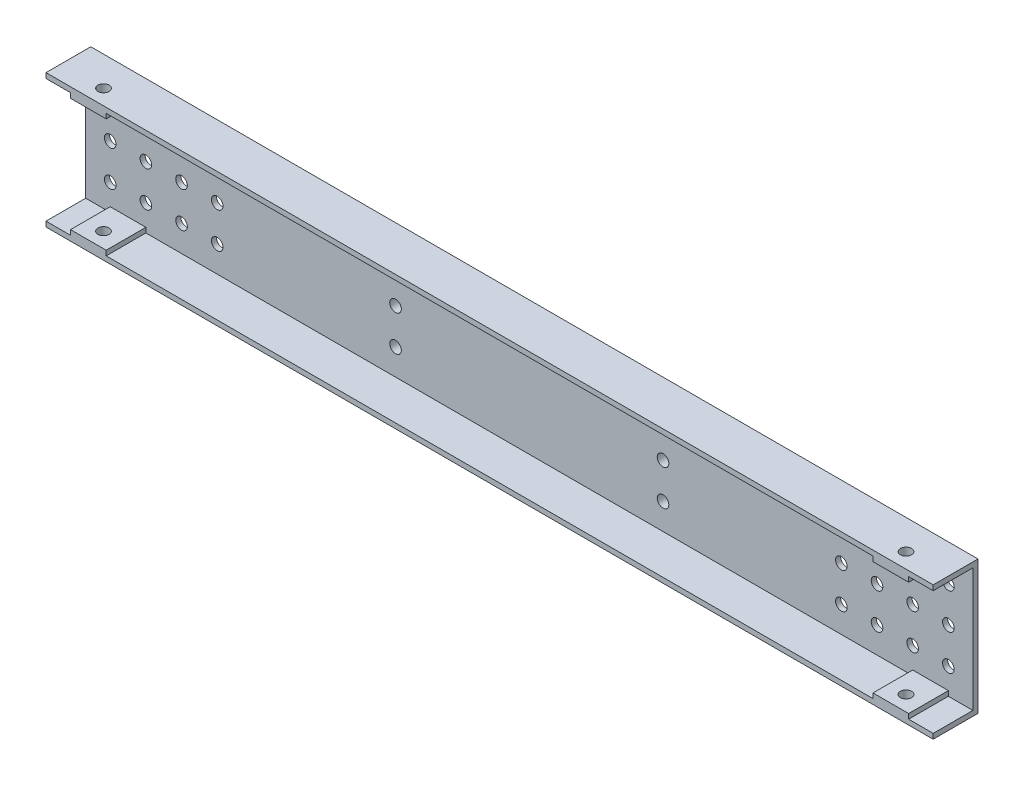
from build123d import *

# Parameters (mm, degrees)
SKETCH_1_W             = 1990
SKETCH_1_H             = 300
SKETCH_1_R             = 13
EXTRUDE_464_DEPTH      = 11.5
EXTRUDE_1_DEPTH        = 89
SKETCH_3_R             = 13
CUT_EXTRUDE_1_DEPTH    = 1045.090633039
PATTERN_LINEAR_1_COUNT = 3
PATTERN_LINEAR_1_PITCH = 80
EXTRUDE_START          = 16
SKETCH_7_W             = 70
SKETCH_7_H             = 230
SKETCH_7_R             = 13
EXTRUDE_2_DEPTH        = 16
SKETCH_8_R             = 12.5
CUT_EXTRUDE_2_DEPTH    = 1045.090633039


with BuildPart() as part:
    # 草图1 → Extrude 464 (new body)
    with BuildSketch(Plane.XY):
        with Locations((0, 150)):
            Rectangle(SKETCH_1_W, SKETCH_1_H)
        with Locations((300, 230)):
            Circle(SKETCH_1_R, mode=Mode.SUBTRACT)
        with Locations((300, 150)):
            Circle(SKETCH_1_R, mode=Mode.SUBTRACT)
        with Locations((300, 70)):
            Circle(SKETCH_1_R, mode=Mode.SUBTRACT)
        with Locations(Location((-300, 70, 0), (0, 0, 180))):
            Circle(SKETCH_1_R, mode=Mode.SUBTRACT)
        with Locations(Location((-300, 150, 0), (0, 0, 180))):
            Circle(SKETCH_1_R, mode=Mode.SUBTRACT)
        with Locations(Location((-300, 230, 0), (0, 0, 180))):
            Circle(SKETCH_1_R, mode=Mode.SUBTRACT)
    extrude(amount=EXTRUDE_464_DEPTH)

    # 草图2 → 凸台-拉伸1 (add)
    with BuildSketch(Plane.XY.offset(11.5)):
        Polygon((-995, 300), (995, 300), (995, 288.5), (940, 288.5), (940, 277.5), (860, 277.5), (860, 288.5), (-860, 288.5), (-860, 277.5), (-940, 277.5), (-940, 288.5), (-995, 288.5), align=None)
        Polygon((-995, 0), (995, 0), (995, 11.5), (940, 11.5), (940, 22.5), (860, 22.5), (860, 11.5), (-860, 11.5), (-860, 22.5), (-940, 22.5), (-940, 11.5), (-995, 11.5), align=None)
    extrude(amount=EXTRUDE_1_DEPTH)

    # 草图3 → 切除-拉伸1 (cut, through all)
    with BuildSketch(Plane(origin=(0, 0, 0), x_dir=(-1, 0, 0), z_dir=(0, 0, -1))):
        with Locations((940, 70)):
            Circle(SKETCH_3_R)
        with Locations((860, 70)):
            Circle(SKETCH_3_R)
        with Locations((780, 70)):
            Circle(SKETCH_3_R)
        with Locations((700, 70)):
            Circle(SKETCH_3_R)
        with Locations((-940, 70)):
            Circle(SKETCH_3_R)
        with Locations((-860, 70)):
            Circle(SKETCH_3_R)
        with Locations((-780, 70)):
            Circle(SKETCH_3_R)
        with Locations((-700, 70)):
            Circle(SKETCH_3_R)
    cut_extrude_1 = extrude(amount=-CUT_EXTRUDE_1_DEPTH, mode=Mode.SUBTRACT)

    # 阵列(线性)1: 切除-拉伸1 ×3
    with Locations(*[(0, i * PATTERN_LINEAR_1_PITCH, 0) for i in range(1, PATTERN_LINEAR_1_COUNT)]):
        add(cut_extrude_1, mode=Mode.SUBTRACT)

    # 草图7 → 凸台-拉伸2 (add)
    # profile 1 of 2: a face of its own
    with BuildSketch(Plane(origin=(0, 0, 0), x_dir=(-1, 0, 0), z_dir=(0, 0, -1)).offset(EXTRUDE_START)):
        with Locations((300, 150)):
            Rectangle(SKETCH_7_W, SKETCH_7_H)
        with Locations((300, 230)):
            Circle(SKETCH_7_R, mode=Mode.SUBTRACT)
        with Locations((300, 150)):
            Circle(SKETCH_7_R, mode=Mode.SUBTRACT)
        with Locations((300, 70)):
            Circle(SKETCH_7_R, mode=Mode.SUBTRACT)
    # profile 2 of 2: a face of its own
    with BuildSketch(Plane(origin=(0, 0, 0), x_dir=(-1, 0, 0), z_dir=(0, 0, -1)).offset(EXTRUDE_START)):
        with Locations((-300, 150)):
            Rectangle(SKETCH_7_W, SKETCH_7_H)
        with Locations(Location((-300, 70, 0), (0, 0, 180))):
            Circle(SKETCH_7_R, mode=Mode.SUBTRACT)
        with Locations(Location((-300, 150, 0), (0, 0, 180))):
            Circle(SKETCH_7_R, mode=Mode.SUBTRACT)
        with Locations(Location((-300, 230, 0), (0, 0, 180))):
            Circle(SKETCH_7_R, mode=Mode.SUBTRACT)
    extrude(amount=-EXTRUDE_2_DEPTH)

    # 草图8 → 切除-拉伸2 (cut, through all)
    with BuildSketch(Plane(origin=(0, 300, 0), x_dir=(-1, 0, 0), z_dir=(0, 1, 0))):
        with Locations(Location((900, 66.5, 0), (0, 0, 90))):
            Circle(SKETCH_8_R)
        with Locations(Location((-900, 66.5, 0), (0, 0, 270))):
            Circle(SKETCH_8_R)
    extrude(amount=-CUT_EXTRUDE_2_DEPTH, mode=Mode.SUBTRACT)


solid = part.part
